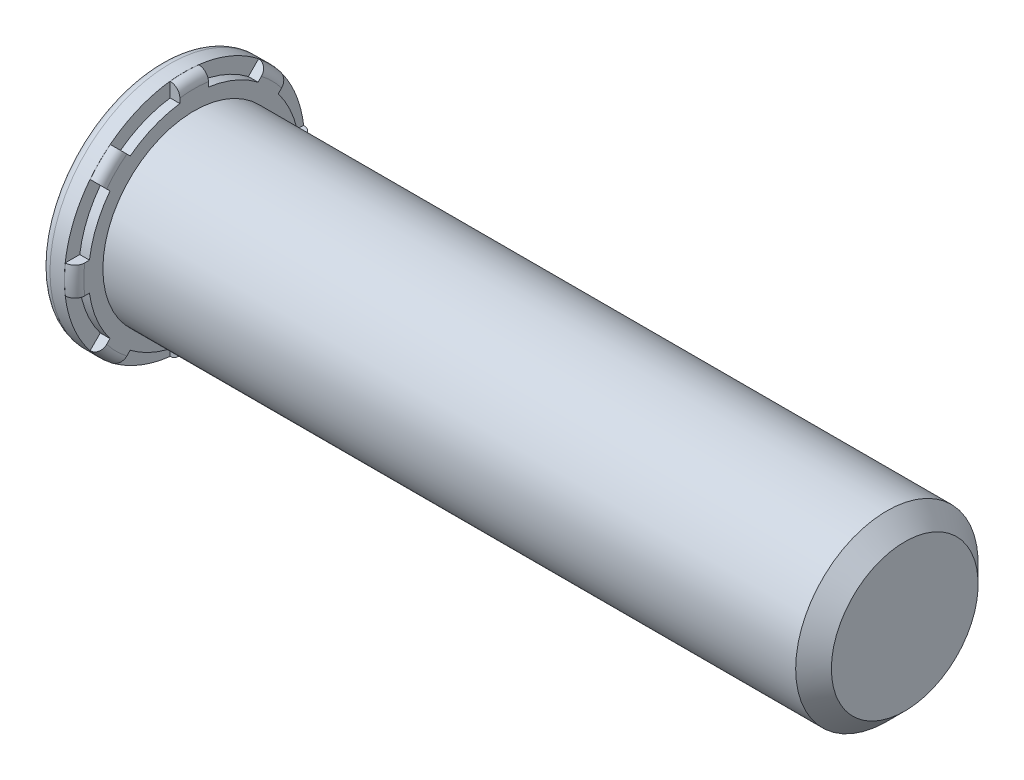
from build123d import *

# Parameters (mm, degrees)
RIBCUT_START     = -0.25654
RIBCUT_DEPTH     = 0.25654
RIBCUTSPAT_COUNT = 8
RIBCUTSPAT_ANGLE = 315


with BuildPart() as part:
    # BodySke → BaseBody (revolve)
    with BuildSketch(Plane.XY):
        with BuildLine():
            Line((-0.635, 2.921), (-0.635, 0))
            Line((-0.635, 0), (19.05, 0))
            Line((19.05, 0), (19.05, 1.94056))
            Line((19.05, 1.94056), (18.57756, 2.413))
            Line((18.57756, 2.413), (0.25654, 2.413))
            Line((0.25654, 2.413), (0.25654, 2.91846))
            ThreePointArc((0.25654, 2.91846), (0.182145122, 3.098065122), (0.00254, 3.17246))
            Line((0.00254, 3.17246), (0, 3.17246))
            Line((0, 3.17246), (0, 3.175))
            Line((0, 3.175), (-0.381, 3.175))
            ThreePointArc((-0.381, 3.175), (-0.560605122, 3.100605122), (-0.635, 2.921))
        make_face()
    revolve(axis=Axis((0, 0, 0), (1, 0, 0)))

    # RibCutSke → RibCut (cut)
    with BuildSketch(Plane(origin=(0.25654, 1.794401132, -0.090952894), x_dir=(0, 0, -1), z_dir=(1, 0, 0)).offset(RIBCUT_START)):
        with BuildLine():
            Line((0.28652347, 0.973982438), (0.28652347, 1.35807989))
            ThreePointArc((0.28652347, 1.35807989), (1.124067004, 1.138916383), (1.871271717, 0.701655673))
            Line((1.871271717, 0.701655673), (1.599673805, 0.43005776))
            ThreePointArc((1.599673805, 0.43005776), (0.978264616, 0.786918281), (0.28652347, 0.973982438))
        make_face()
    ribcut = extrude(amount=RIBCUT_DEPTH, mode=Mode.SUBTRACT)

    # RibCutsPat: RibCut ×8 about axis
    ribcutspat_axis = Axis((0, 0, 0), (1, 0, 0))
    for i in range(1, RIBCUTSPAT_COUNT):
        add(ribcut.rotate(ribcutspat_axis, i * RIBCUTSPAT_ANGLE / (RIBCUTSPAT_COUNT - 1)), mode=Mode.SUBTRACT)


solid = part.part
